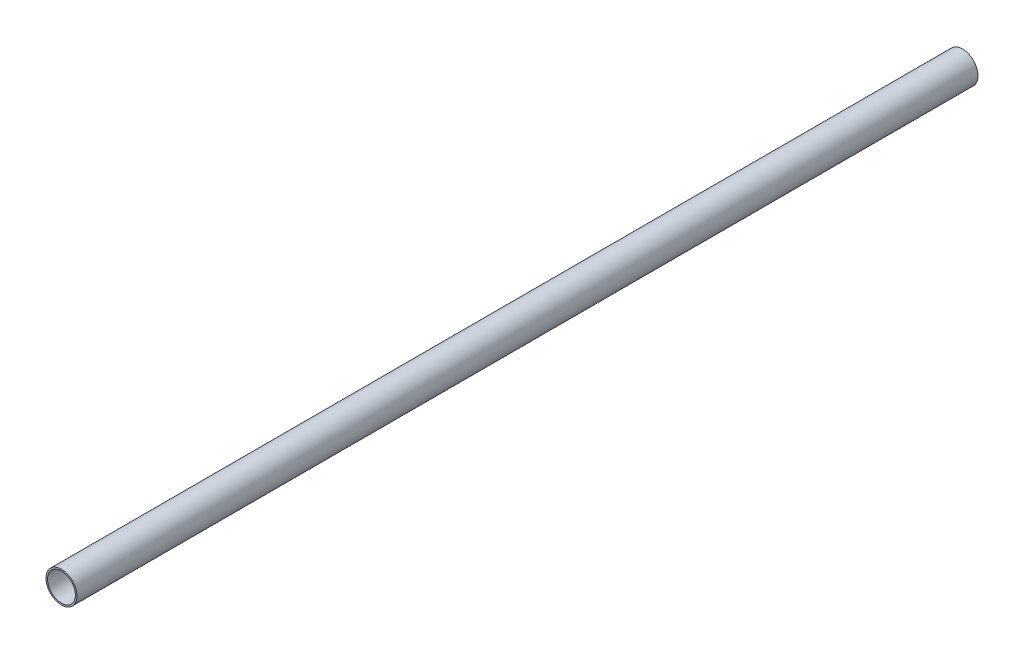
from build123d import *

# Parameters (mm, degrees)
SKETCH1_R           = 5
BOSS_EXTRUDE1_DEPTH = 145.5
SHELL1_T            = -0.5


with BuildPart() as part:
    # Sketch1 → Boss-Extrude1 (new, symmetric)
    with BuildSketch(Plane.XY):
        Circle(SKETCH1_R)
    extrude(amount=BOSS_EXTRUDE1_DEPTH, both=True)

    # Shell1
    shell1_openings = [part.faces().sort_by_distance(p)[0] for p in [
        (0, 0, 145.5),
        (0, 0, -145.5),
    ]]
    offset(amount=SHELL1_T, openings=shell1_openings, kind=Kind.INTERSECTION)


solid = part.part
